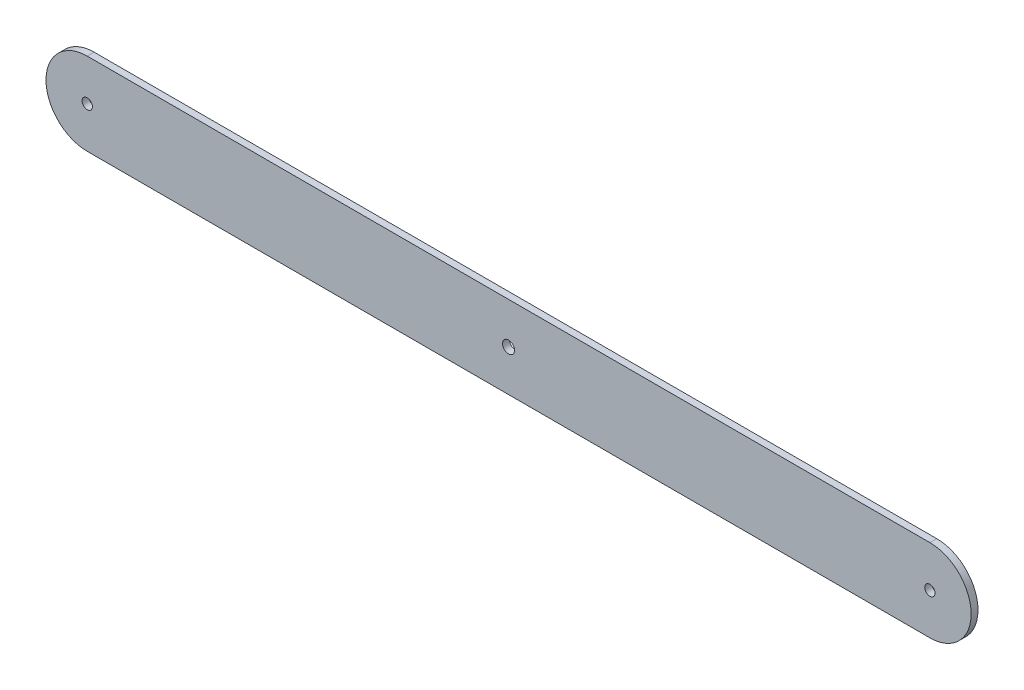
from build123d import *

# Parameters (mm, degrees)
SKETCH1_R           = 1.5
SKETCH1_R_2         = 1.75
BOSS_EXTRUDE1_DEPTH = 2


with BuildPart() as part:
    # Sketch1 → Boss-Extrude1 (new body)
    with BuildSketch(Plane.XY):
        with BuildLine():
            Line((-122.6, 12), (122.6, 12))
            ThreePointArc((122.6, 12), (134.6, 0), (122.6, -12))
            Line((122.6, -12), (-122.6, -12))
            ThreePointArc((-122.6, -12), (-134.6, 0), (-122.6, 12))
        make_face()
        with Locations((-122.6, 0)):
            Circle(SKETCH1_R, mode=Mode.SUBTRACT)
        Circle(SKETCH1_R_2, mode=Mode.SUBTRACT)
        with Locations((122.6, 0)):
            Circle(SKETCH1_R, mode=Mode.SUBTRACT)
    extrude(amount=BOSS_EXTRUDE1_DEPTH)


solid = part.part
